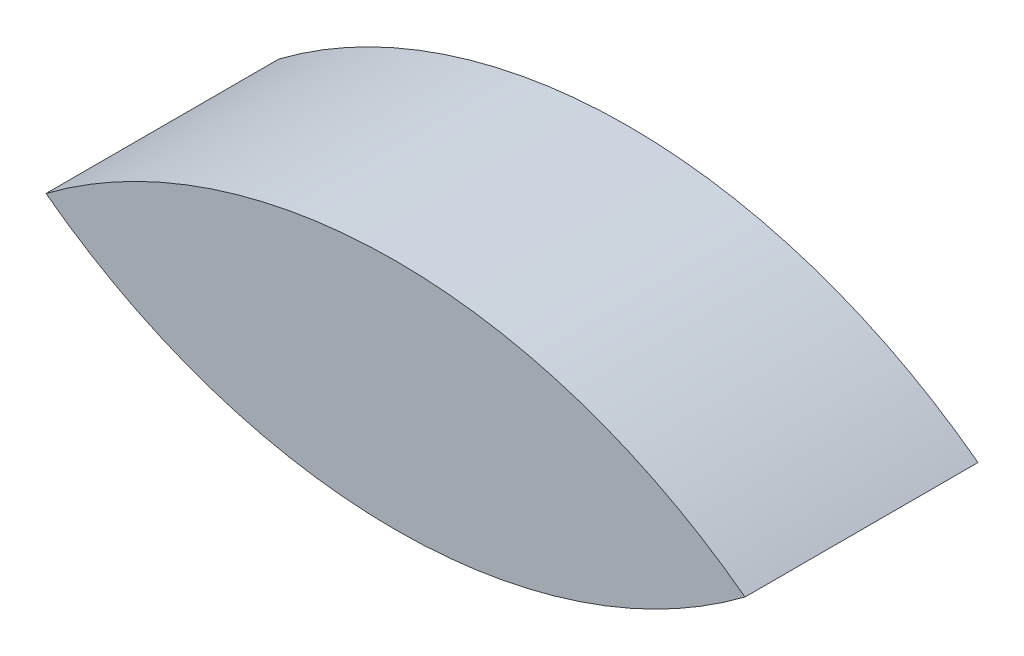
from build123d import *

# Parameters (mm, degrees)
EXTRUDE_1_DEPTH = 5


with BuildPart() as part:
    # Эскиз1 → Бобышка-Вытянуть1 (new, symmetric)
    with BuildSketch(Plane.XY):
        with BuildLine():
            ThreePointArc((-15, 0), (0, 5), (15, 0))
            ThreePointArc((15, 0), (0, -5), (-15, 0))
        make_face()
    extrude(amount=EXTRUDE_1_DEPTH, both=True)


solid = part.part
